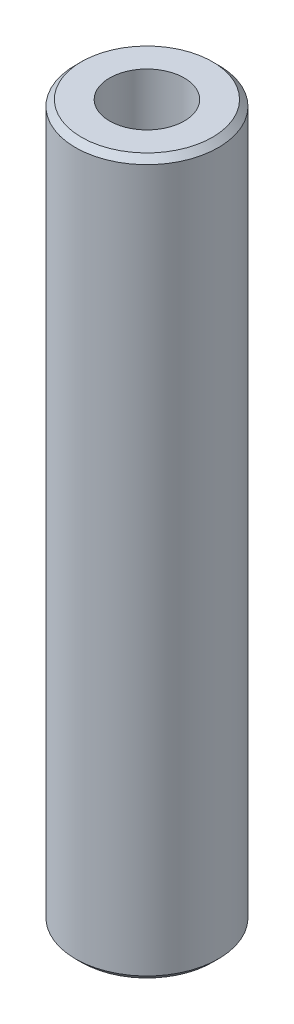
from build123d import *

# Parameters (mm, degrees)
CROQUIS2_R                = 4.7625
SALIENTE_EXTRUIR1_DEPTH   = 23.8125
CHAFL_N1_SIZE             = 0.396875
CLEARANCE_HOLE_DEPTH      = 25.746675913
CLEARANCE_HOLE_DEPTH_BACK = 25.746675913
CROQUIS4_R                = 2.4892


with BuildPart() as part:
    # Croquis2 → Saliente-Extruir1 (new, symmetric)
    with BuildSketch(Plane(origin=(0, 0, 0), x_dir=(1, 0, 0), z_dir=(0, 1, 0))):
        Circle(CROQUIS2_R)
    extrude(amount=SALIENTE_EXTRUIR1_DEPTH, both=True)

    # Chaflán1
    chafl_n1_edges = [part.edges().sort_by_distance(p)[0] for p in [
        (-4.7625, -23.8125, 0),
        (-4.7625, 23.8125, 0),
    ]]
    chamfer(chafl_n1_edges, length=CHAFL_N1_SIZE)

    # Croquis4 → Clearance Hole (cut, two sides: drawn at the far end of the back side and taken through both)
    with BuildSketch(Plane(origin=(0, 0, 0), x_dir=(1, 0, 0), z_dir=(0, 1, 0)).offset(-CLEARANCE_HOLE_DEPTH_BACK)):
        Circle(CROQUIS4_R)
    extrude(amount=CLEARANCE_HOLE_DEPTH + CLEARANCE_HOLE_DEPTH_BACK, mode=Mode.SUBTRACT)


solid = part.part
